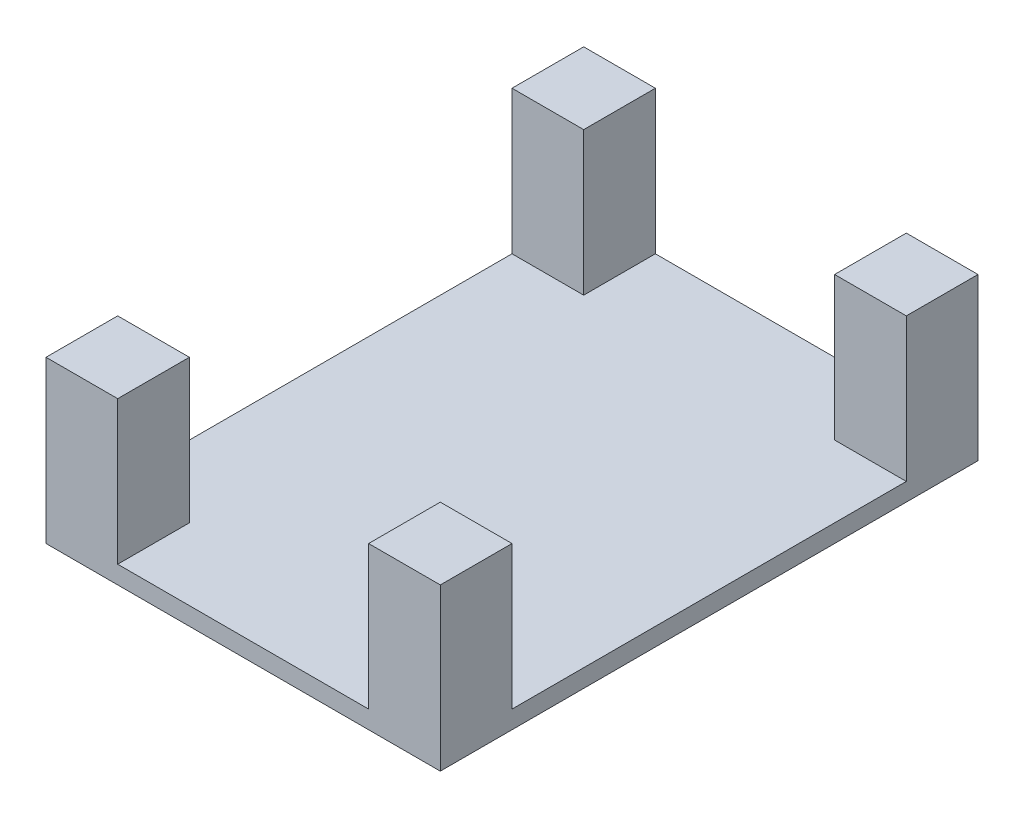
from build123d import *

# Parameters (mm, degrees)
SKETCH_2_W      = 110
SKETCH_2_H      = 150
EXTRUDE_1_DEPTH = 5
SKETCH_3_W      = 20
SKETCH_3_H      = 20
EXTRUDE_2_DEPTH = 40


with BuildPart() as part:
    # 草图2 → 凸台-拉伸1 (new body)
    with BuildSketch(Plane(origin=(0, 0, 0), x_dir=(1, 0, 0), z_dir=(0, 1, 0))):
        with Locations((55, 75)):
            Rectangle(SKETCH_2_W, SKETCH_2_H)
    extrude(amount=EXTRUDE_1_DEPTH)

    # 草图3 → 凸台-拉伸2 (add)
    with BuildSketch(Plane(origin=(0, 5, 0), x_dir=(1, 0, 0), z_dir=(0, 1, 0))):
        with Locations((10, 140)):
            Rectangle(SKETCH_3_W, SKETCH_3_H)
        with Locations((10, 10)):
            Rectangle(SKETCH_3_W, SKETCH_3_H)
        with Locations((100, 10)):
            Rectangle(SKETCH_3_W, SKETCH_3_H)
        with Locations((100, 140)):
            Rectangle(SKETCH_3_W, SKETCH_3_H)
    extrude(amount=EXTRUDE_2_DEPTH)


solid = part.part
